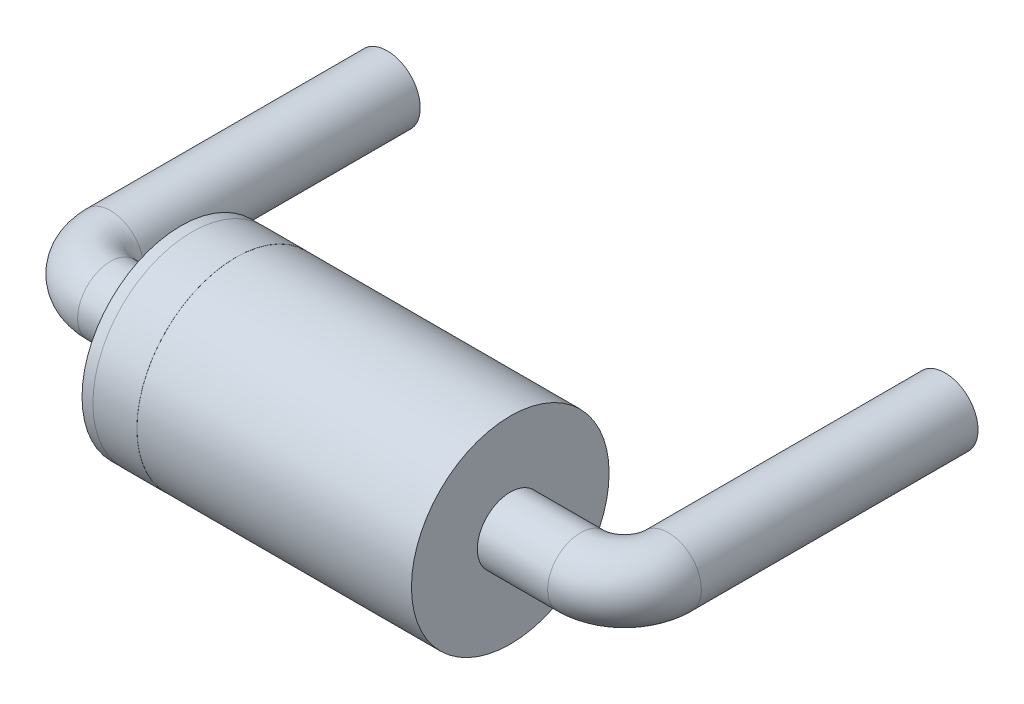
from build123d import *

# Parameters (mm, degrees)
IZIM2_R                     = 0.3
IZIM4_R                     = 0.9
Y_KSEKLIK_EKSTR_ZYON3_DEPTH = 1.5
EKSTR_ZYON_NCE1_START       = -1.2
IZIM4_5_R                   = 0.901
IZIM4_5_R_2                 = 0.9
EKSTR_ZYON_NCE1_DEPTH       = 0.2


with BuildPart() as part:
    # Süpür2: sweep along a path in Çizim3
    with BuildLine(Plane(origin=(0, 0, 0), x_dir=(1, 0, 0), z_dir=(0, 1, 0))) as s_p_r2_path:
        Line((2.54, 2), (2.54, -0.52))
        ThreePointArc((2.54, -0.52), (2.422842712, -0.802842712), (2.14, -0.92))
        Line((2.14, -0.92), (-2.14, -0.92))
        ThreePointArc((-2.14, -0.92), (-2.422842712, -0.802842712), (-2.54, -0.52))
        Line((-2.54, -0.52), (-2.54, 2))
    # Çizim2 → Süpür2 (sweep)
    with BuildSketch(Plane(origin=(0, 0, -2), x_dir=(-1, 0, 0), z_dir=(0, 0, -1))):
        with Locations((-2.54, 0)):
            Circle(IZIM2_R)
    sweep(path=s_p_r2_path.line)

    # Çizim4 → Yükseklik-Ekstrüzyon3 (add, symmetric)
    with BuildSketch(Plane(origin=(0, 0, 0), x_dir=(0, 0, -1), z_dir=(1, 0, 0))):
        with Locations((-0.92, 0)):
            Circle(IZIM4_R)
    extrude(amount=Y_KSEKLIK_EKSTR_ZYON3_DEPTH, both=True)

    # Çizim4<5> → Ekstrüzyon-İnce1 (add, symmetric)
    with BuildSketch(Plane(origin=(0, 0, 0), x_dir=(0, 0, -1), z_dir=(1, 0, 0)).offset(EKSTR_ZYON_NCE1_START)):
        with Locations((-0.92, 0)):
            Circle(IZIM4_5_R)
        with Locations((-0.92, 0)):
            Circle(IZIM4_5_R_2, mode=Mode.SUBTRACT)
    extrude(amount=EKSTR_ZYON_NCE1_DEPTH, both=True)


solid = part.part
